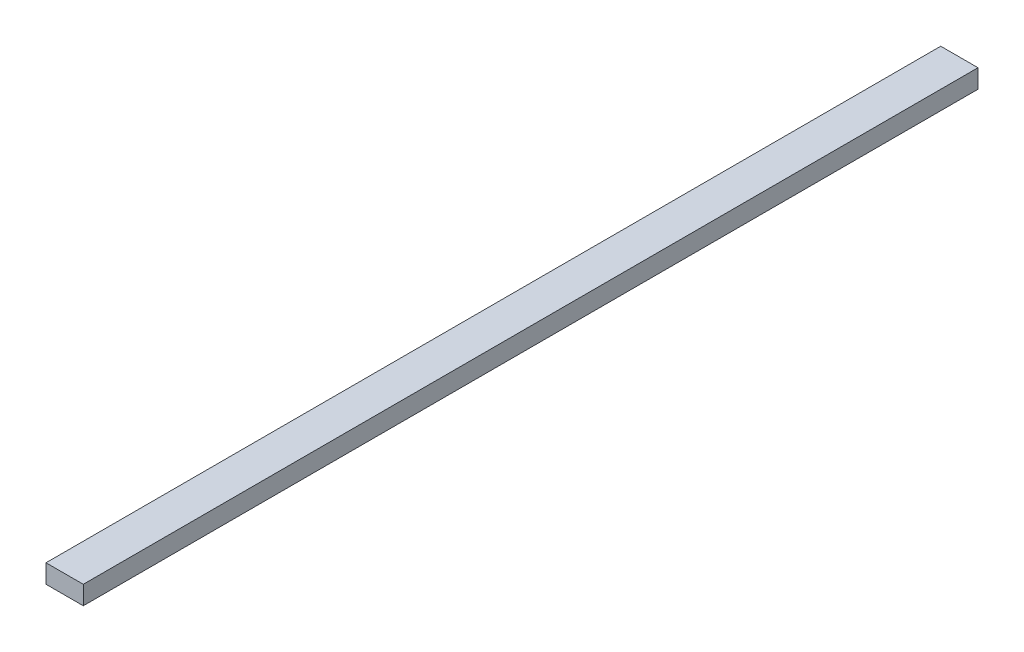
from build123d import *

# Parameters (mm, degrees)
SKETCH1_W           = 50.8
SKETCH1_H           = 25.4
BOSS_EXTRUDE3_DEPTH = 1219.2


with BuildPart() as part:
    # Sketch1 → Boss-Extrude3 (new body)
    with BuildSketch(Plane.XY):
        Rectangle(SKETCH1_W, SKETCH1_H)
    extrude(amount=BOSS_EXTRUDE3_DEPTH)


solid = part.part
